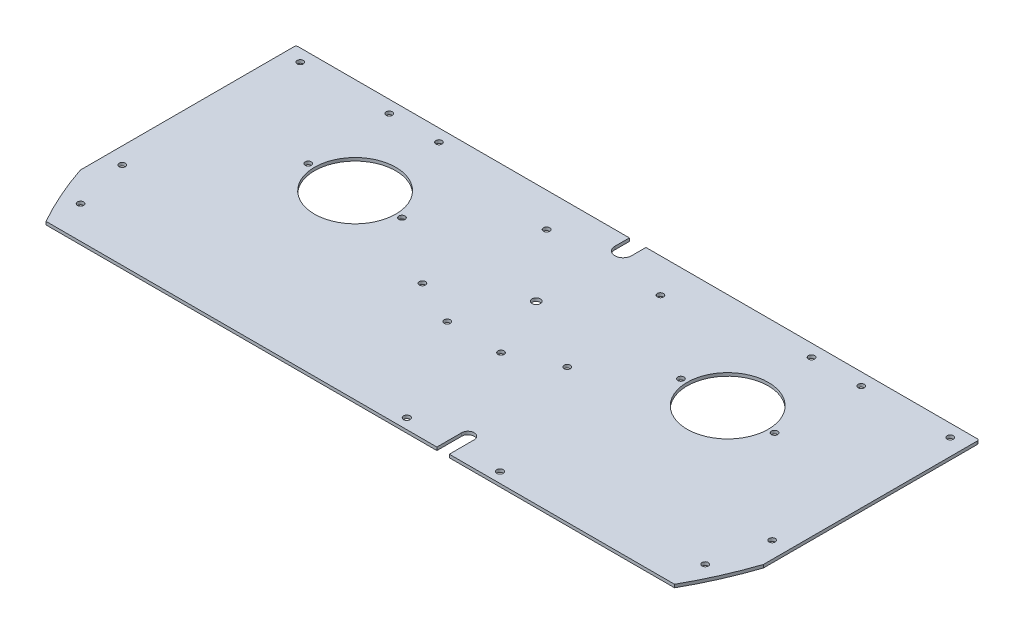
from build123d import *

# Parameters (mm, degrees)
BOSS_EXTRU_1_DEPTH       = 1.5
ESQUISSE7_R              = 1.5
ENL_V_MAT_EXTRU_5_DEPTH  = 230.841793415
ESQUISSE8_R              = 19.627416998
ESQUISSE8_R_2            = 1.5
ENL_V_MAT_EXTRU_6_DEPTH  = 230.841793415
ESQUISSE9_R              = 1.5
ESQUISSE9_R_2            = 2
ENL_V_MAT_EXTRU_7_DEPTH  = 230.841793415
ENL_V_MAT_EXTRU_8_DEPTH  = 230.841793415
CONG_1_R                 = 1
ESQUISSE11_R             = 1.5
ENL_V_MAT_EXTRU_9_DEPTH  = 230.841793415
ESQUISSE12_R             = 1.6
ESQUISSE12_W             = 330
ESQUISSE12_H             = 75
ENL_V_MAT_EXTRU_10_DEPTH = 230.841793415


with BuildPart() as part:
    # Esquisse1 → Boss.-Extru.1 (new body)
    with BuildSketch(Plane(origin=(0, 0, 0), x_dir=(1, 0, 0), z_dir=(0, 1, 0))):
        with BuildLine():
            Line((0, 49), (165, 49))
            Line((165, 49), (165, -55.235857919))
            ThreePointArc((165, -55.235857919), (127.908511428, -117.963607542), (68.381283989, -160))
            Line((68.381283989, -160), (0, -160))
            Line((0, -160), (0, 49))
        make_face()
    extrude(amount=BOSS_EXTRU_1_DEPTH)

    # Symétrie1: part across plane


with BuildPart() as part_1:
    add(part.part)
    add(part.part.mirror(Plane(origin=(0, 1.5, -49), x_dir=(0, 0, 1), z_dir=(1, 0, 0))))

    # Esquisse7 → Enlèv. mat.-Extru.5 (cut, through all)
    with BuildSketch(Plane(origin=(0, 1.5, 0), x_dir=(1, 0, 0), z_dir=(0, 1, 0))):
        with Locations(Location((-157, -43, 0), (0, 0, 270))):
            Circle(ESQUISSE7_R)
        with Locations(Location((157, -43, 0), (0, 0, 270))):
            Circle(ESQUISSE7_R)
        with Locations(Location((157, 43, 0), (0, 0, 270))):
            Circle(ESQUISSE7_R)
        with Locations(Location((-157, 43, 0), (0, 0, 270))):
            Circle(ESQUISSE7_R)
        with Locations(Location((-114, 43, 0), (0, 0, 270))):
            Circle(ESQUISSE7_R)
        with Locations(Location((-90, 43, 0), (0, 0, 270))):
            Circle(ESQUISSE7_R)
        with Locations(Location((90, 43, 0), (0, 0, 90))):
            Circle(ESQUISSE7_R)
        with Locations(Location((114, 43, 0), (0, 0, 90))):
            Circle(ESQUISSE7_R)
    extrude(amount=-ENL_V_MAT_EXTRU_5_DEPTH, mode=Mode.SUBTRACT)

    # Esquisse8 → Enlèv. mat.-Extru.6 (cut, through all)
    with BuildSketch(Plane(origin=(0, 1.5, 0), x_dir=(1, 0, 0), z_dir=(0, 1, 0))):
        with Locations(Location((-90, 2.5, 0), (0, 0, 270))):
            Circle(ESQUISSE8_R)
        with Locations(Location((-112.627416998, 2.5, 0), (0, 0, 270))):
            Circle(ESQUISSE8_R_2)
        with Locations(Location((-67.372583002, 2.5, 0), (0, 0, 270))):
            Circle(ESQUISSE8_R_2)
        with Locations(Location((112.627416998, 2.5, 0), (0, 0, 90))):
            Circle(ESQUISSE8_R_2)
        with Locations(Location((67.372583002, 2.5, 0), (0, 0, 90))):
            Circle(ESQUISSE8_R_2)
        with Locations(Location((90, 2.5, 0), (0, 0, 90))):
            Circle(ESQUISSE8_R)
    extrude(amount=-ENL_V_MAT_EXTRU_6_DEPTH, mode=Mode.SUBTRACT)

    # Esquisse9 → Enlèv. mat.-Extru.7 (cut, through all)
    with BuildSketch(Plane(origin=(0, 1.5, 0), x_dir=(1, 0, 0), z_dir=(0, 1, 0))):
        with Locations(Location((27.5, 32.5, 0), (0, 0, 270))):
            Circle(ESQUISSE9_R)
        with Locations(Location((-13, -30, 0), (0, 0, 270))):
            Circle(ESQUISSE9_R)
        with Locations(Location((35, -20, 0), (0, 0, 270))):
            Circle(ESQUISSE9_R)
        with Locations(Location((-27.5, 32.5, 0), (0, 0, 90))):
            Circle(ESQUISSE9_R)
        with Locations(Location((0, 0, 0), (0, 0, 270))):
            Circle(ESQUISSE9_R_2)
        with Locations(Location((-35, -20, 0), (0, 0, 90))):
            Circle(ESQUISSE9_R)
        with Locations(Location((13, -30, 0), (0, 0, 90))):
            Circle(ESQUISSE9_R)
        with BuildLine():
            Line((4, 49), (4, 42))
            ThreePointArc((4, 42), (0, 38), (-4, 42))
            Line((-4, 42), (-4, 49))
            ThreePointArc((-4, 49), (0, 53), (4, 49))
        make_face()
    extrude(amount=-ENL_V_MAT_EXTRU_7_DEPTH, mode=Mode.SUBTRACT)

    # Esquisse10 → Enlèv. mat.-Extru.8 (cut, through all)
    with BuildSketch(Plane(origin=(0, 1.5, 0), x_dir=(1, 0, 0), z_dir=(0, 1, 0))):
        with BuildLine():
            Line((43, -73), (43, -150))
            ThreePointArc((43, -150), (40, -153), (37, -150))
            Line((37, -150), (37, -73))
            ThreePointArc((37, -73), (40, -70), (43, -73))
        make_face()
    extrude(amount=-ENL_V_MAT_EXTRU_8_DEPTH, mode=Mode.SUBTRACT)

    # Congé1
    cong_1_edges = [part_1.edges().sort_by_distance(p)[0] for p in [
        (-165, 0.75, -49),
        (165, 0.75, -49),
    ]]
    fillet(cong_1_edges, radius=CONG_1_R)

    # Esquisse11 → Enlèv. mat.-Extru.9 (cut, through all)
    with BuildSketch(Plane(origin=(0, 1.5, 0), x_dir=(1, 0, 0), z_dir=(0, 1, 0))):
        with Locations(Location((-150.869773386, -69.240966765, 0), (0, 0, 270))):
            Circle(ESQUISSE11_R)
        with Locations(Location((-116.399964779, -118.351375994, 0), (0, 0, 270))):
            Circle(ESQUISSE11_R)
        with Locations(Location((-66.72330927, -152, 0), (0, 0, 270))):
            Circle(ESQUISSE11_R)
        with Locations(Location((66.72330927, -152, 0), (0, 0, 90))):
            Circle(ESQUISSE11_R)
        with Locations(Location((116.399964779, -118.351375994, 0), (0, 0, 90))):
            Circle(ESQUISSE11_R)
        with Locations(Location((150.869773386, -69.240966765, 0), (0, 0, 90))):
            Circle(ESQUISSE11_R)
        with Locations(Location((-15, -152, 0), (0, 0, 270))):
            Circle(ESQUISSE11_R)
        with Locations(Location((15, -152, 0), (0, 0, 90))):
            Circle(ESQUISSE11_R)
    extrude(amount=-ENL_V_MAT_EXTRU_9_DEPTH, mode=Mode.SUBTRACT)

    # Esquisse12 → Enlèv. mat.-Extru.10 (cut, through all)
    with BuildSketch(Plane(origin=(0, 1.5, 0), x_dir=(1, 0, 0), z_dir=(0, 1, 0))):
        with Locations(Location((17.5, -80, 0), (0, 0, 270))):
            Circle(ESQUISSE12_R)
        with Locations(Location((62.5, -80, 0), (0, 0, 270))):
            Circle(ESQUISSE12_R)
        with Locations((0, -122.5)):
            Rectangle(ESQUISSE12_W, ESQUISSE12_H)
    extrude(amount=-ENL_V_MAT_EXTRU_10_DEPTH, mode=Mode.SUBTRACT)


solid = part_1.part
